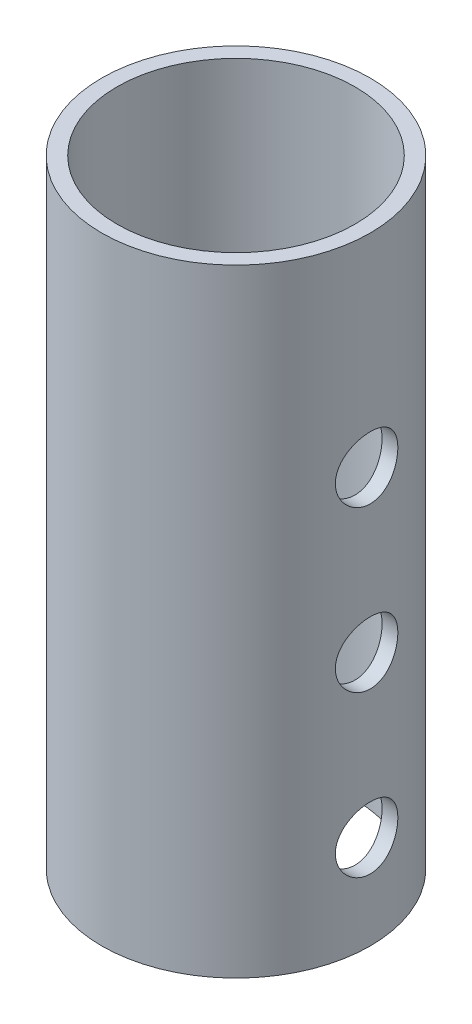
from build123d import *

# Parameters (mm, degrees)
SKETCH1_R           = 42.725
SKETCH1_R_2         = 37.875
BOSS_EXTRUDE1_DEPTH = 196.5
SKETCH2_R           = 9.94
CUT_EXTRUDE1_DEPTH  = 206.57991451
SKETCH4_R           = 7.5
CUT_EXTRUDE2_DEPTH  = 206.579914647


with BuildPart() as part:
    # Sketch1 → Boss-Extrude1 (new body)
    with BuildSketch(Plane(origin=(0, 0, 0), x_dir=(1, 0, 0), z_dir=(0, 1, 0))):
        with Locations(Location((0, 0, 0), (0, 0, 270))):
            Circle(SKETCH1_R)
        with Locations(Location((0, 0, 0), (0, 0, 270))):
            Circle(SKETCH1_R_2, mode=Mode.SUBTRACT)
    extrude(amount=BOSS_EXTRUDE1_DEPTH)

    # Sketch2 → Cut-Extrude1 (cut, through all)
    with BuildSketch(Plane(origin=(0, 0, 0), x_dir=(0, 0, -1), z_dir=(1, 0, 0))):
        with Locations(Location((0, 131.8, 0), (0, 0, 180))):
            Circle(SKETCH2_R)
        with Locations(Location((0, 80.8, 0), (0, 0, 180))):
            Circle(SKETCH2_R)
        with Locations(Location((0, 29.8, 0), (0, 0, 180))):
            Circle(SKETCH2_R)
    extrude(amount=CUT_EXTRUDE1_DEPTH, mode=Mode.SUBTRACT)

    # Sketch4 → Cut-Extrude2 (cut, through all)
    with BuildSketch(Plane(origin=(0, 0, 0), x_dir=(0, 0, -1), z_dir=(1, 0, 0))):
        with Locations((0, 106.3)):
            Circle(SKETCH4_R)
    extrude(amount=-CUT_EXTRUDE2_DEPTH, mode=Mode.SUBTRACT)


solid = part.part
